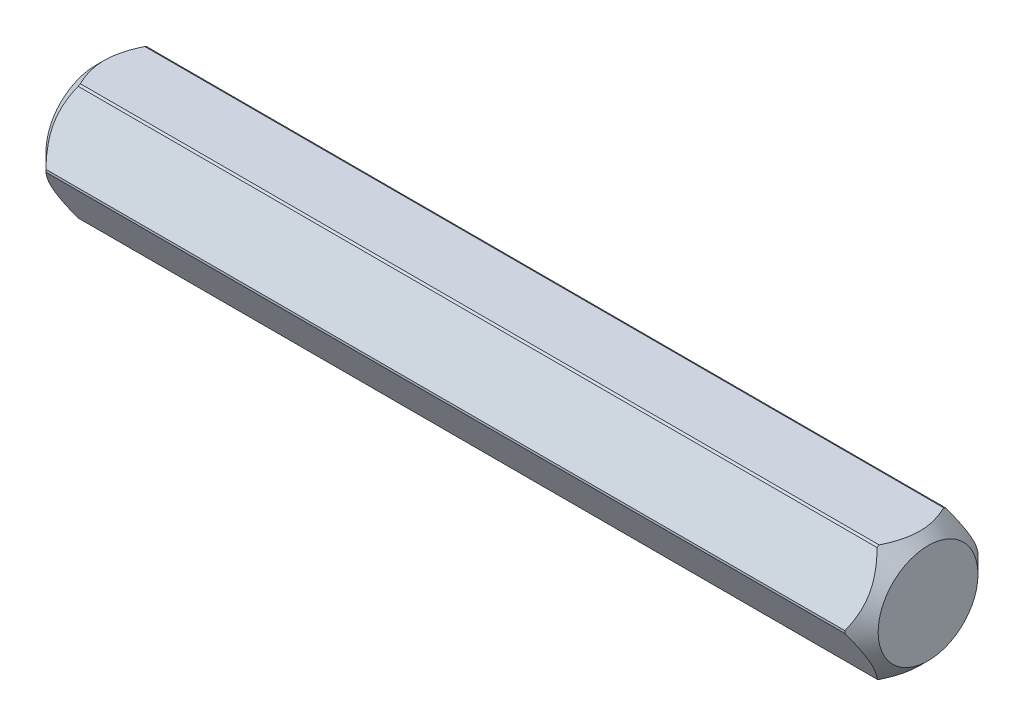
from build123d import *

# Parameters (mm, degrees)
EXTRUDE_306_DEPTH          = 25
CUT_EXTRUDE_407_DEPTH      = 26.565275929
CUT_EXTRUDE_407_DEPTH_BACK = 26.565275929
SKETCH_8_R                 = 5
SKETCH_8_R_2               = 4


with BuildPart() as part:
    # 草图1 → Extrude 306 (new, symmetric)
    with BuildSketch(Plane(origin=(0, 0, 0), x_dir=(0, 0, -1), z_dir=(1, 0, 0))):
        Polygon((4.041451884, 0), (2.020725942, 3.5), (-2.020725942, 3.5), (-4.041451884, 0), (-2.020725942, -3.5), (2.020725942, -3.5), align=None)
    extrude(amount=EXTRUDE_306_DEPTH, both=True)

    # 草图8 → Cut-Extrude 407 (cut, two sides: drawn at the far end of the back side and taken through both)
    with BuildSketch(Plane(origin=(0, 0, 0), x_dir=(0, 0, -1), z_dir=(1, 0, 0)).offset(-CUT_EXTRUDE_407_DEPTH_BACK)):
        Circle(SKETCH_8_R)
        Circle(SKETCH_8_R_2, mode=Mode.SUBTRACT)
    extrude(amount=CUT_EXTRUDE_407_DEPTH + CUT_EXTRUDE_407_DEPTH_BACK, mode=Mode.SUBTRACT)

    # 草图10 → Cut-Revolve 708 (revolve, cut)
    with BuildSketch(Plane.XY, mode=Mode.PRIVATE) as cut_revolve_708_sk:
        Polygon((-25.5, 4), (-24, 4), (-25.5, 2.5), align=None)
        Polygon((24, 4), (25.5, 2.5), (25.5, 4), align=None)
    revolve(cut_revolve_708_sk.sketch.rotate(Axis((25, 0, 0), (-1, 0, 0)), 268.955024372), axis=Axis((25, 0, 0), (-1, 0, 0)), mode=Mode.SUBTRACT)


solid = part.part
